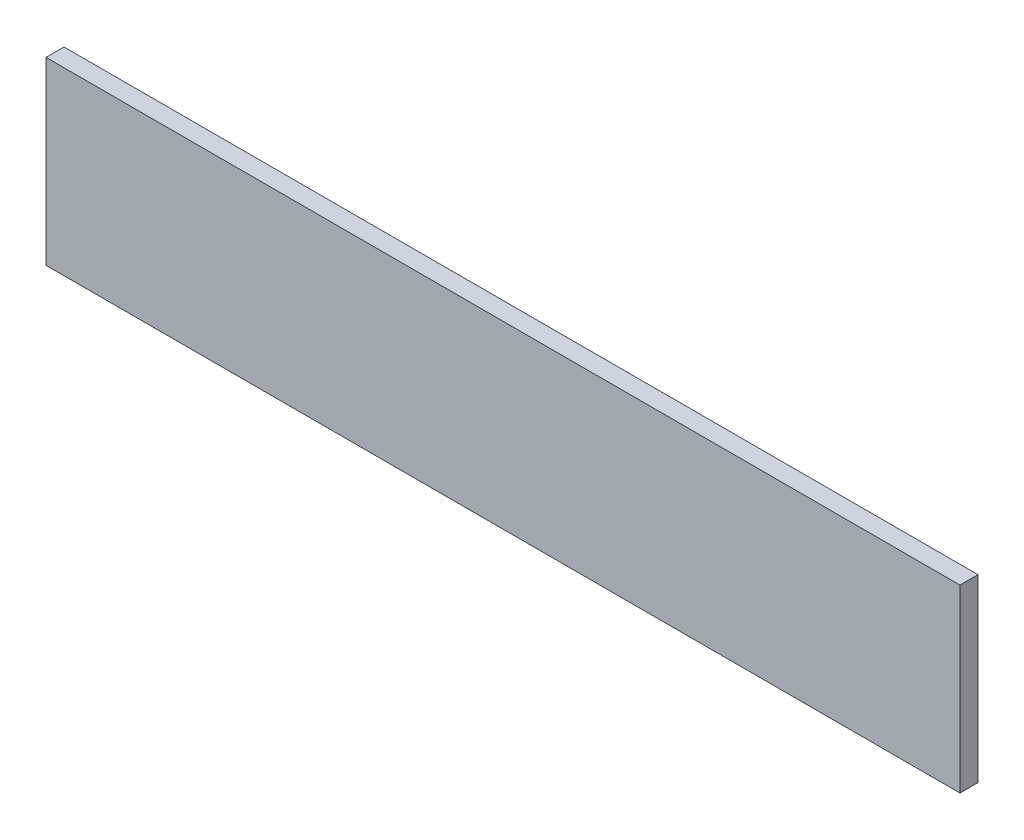
from build123d import *

# Parameters (mm, degrees)
SKETCH_1_W      = 5075
SKETCH_1_H      = 1000
EXTRUDE_1_DEPTH = 100


with BuildPart() as part:
    # Эскиз1 → Бобышка-Вытянуть1 (new body)
    with BuildSketch(Plane.XY):
        with Locations((2537.5, -500)):
            Rectangle(SKETCH_1_W, SKETCH_1_H)
    extrude(amount=EXTRUDE_1_DEPTH)


solid = part.part
